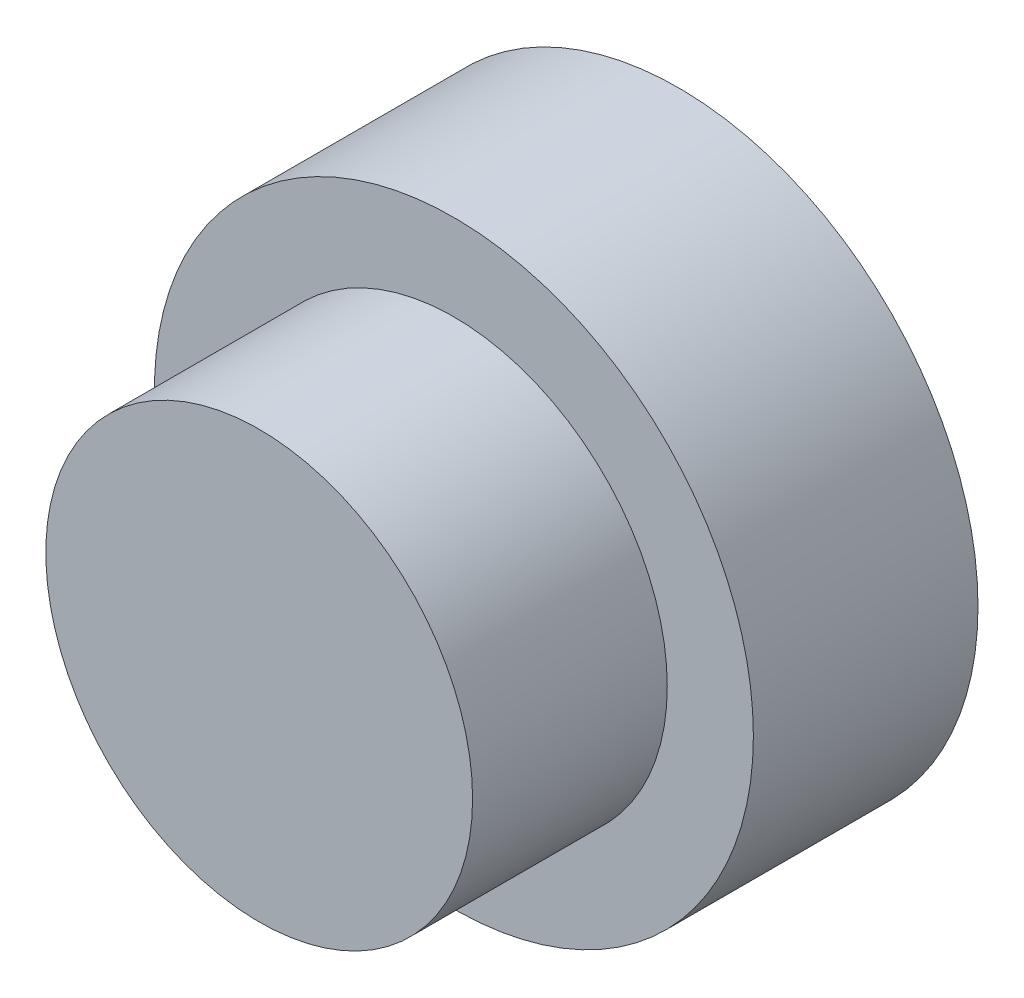
from build123d import *

# Parameters (mm, degrees)
SZKIC1_R                    = 4
DODANIE_WYCI_GNI_CIE1_DEPTH = 3
SZKIC2_R                    = 2.85
DODANIE_WYCI_GNI_CIE2_DEPTH = 2.6


with BuildPart() as part:
    # Szkic1 → Dodanie-wyciągnięcie1 (new body)
    with BuildSketch(Plane.XY):
        with Locations((1040.451511863, -43.532275067)):
            Circle(SZKIC1_R)
    extrude(amount=DODANIE_WYCI_GNI_CIE1_DEPTH)

    # Szkic2 → Dodanie-wyciągnięcie2 (add)
    with BuildSketch(Plane.XY.offset(3)):
        with Locations((1040.451511863, -43.532275067)):
            Circle(SZKIC2_R)
    extrude(amount=DODANIE_WYCI_GNI_CIE2_DEPTH)


solid = part.part
